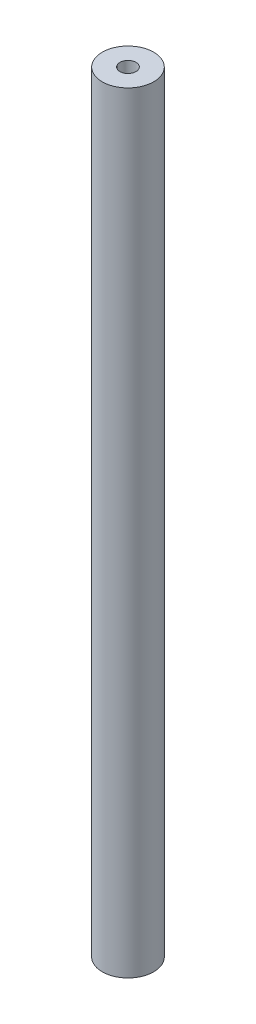
from build123d import *

# Parameters (mm, degrees)
SKETCH_1_R      = 8
EXTRUDE_1_DEPTH = 120


with BuildPart() as part:
    # 草图1 → 凸台-拉伸1 (new, symmetric)
    with BuildSketch(Plane(origin=(0, 0, 0), x_dir=(1, 0, 0), z_dir=(0, 1, 0))):
        with Locations(Location((0, 0, 0), (0, 0, 270))):
            Circle(SKETCH_1_R)
    extrude(amount=EXTRUDE_1_DEPTH, both=True)

    # 草图3 → M6 螺纹孔1 (revolve, cut)
    with BuildSketch(Plane(origin=(0, 120, 0), x_dir=(0, 0, 1), z_dir=(1, 0, 0))):
        Polygon((0, 0), (0, 18.502151548), (2.5, 17), (2.5, 0), align=None)
    hole_wizard_m6_1 = revolve(axis=Axis((0, 126.35, 0), (0, -1, 0)), mode=Mode.SUBTRACT)

    # 镜向1: M6 螺纹孔1 across plane
    add(hole_wizard_m6_1.mirror(Plane.ZX), mode=Mode.SUBTRACT)


solid = part.part
